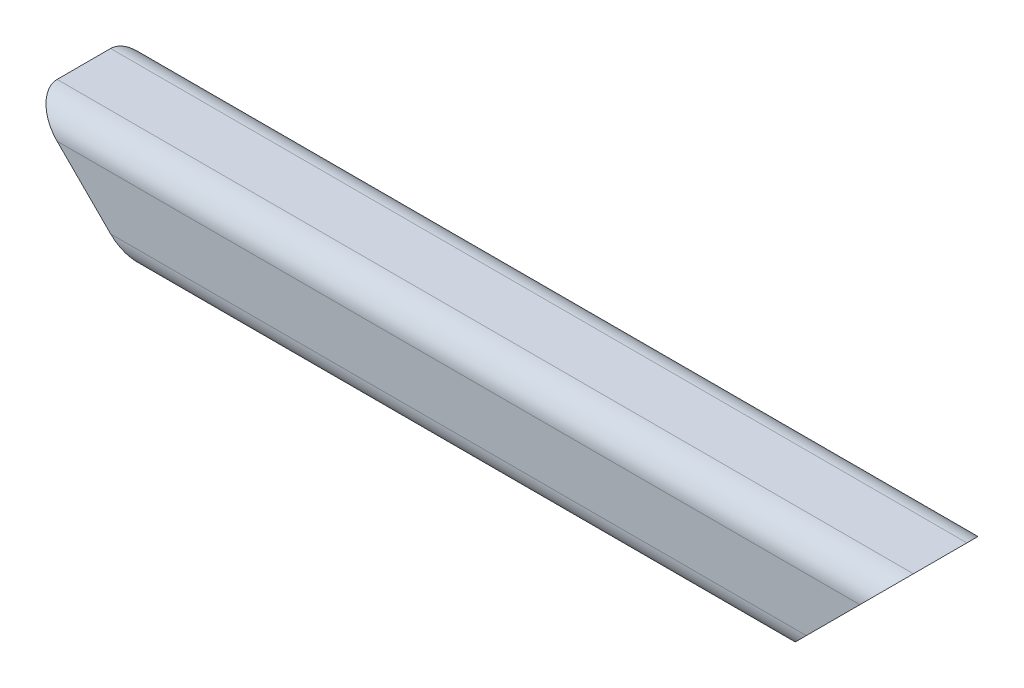
from build123d import *

# Parameters (mm, degrees)
STRUCTURAL_MEMBER1_DEPTH = 406.4
CUT_EXTRUDE1_DEPTH       = 411.349558304


with BuildPart() as part:
    # Sketch11 → Structural Member1 (new body)
    with BuildSketch(Plane.ZY):
        with BuildLine():
            Line((-12.7, -25.4), (12.7, -25.4))
            ThreePointArc((12.7, -25.4), (21.680256121, -21.680256121), (25.4, -12.7))
            Line((25.4, -12.7), (25.4, 12.7))
            ThreePointArc((25.4, 12.7), (21.680256121, 21.680256121), (12.7, 25.4))
            Line((12.7, 25.4), (-12.7, 25.4))
            ThreePointArc((-12.7, 25.4), (-21.680256121, 21.680256121), (-25.4, 12.7))
            Line((-25.4, 12.7), (-25.4, -12.7))
            ThreePointArc((-25.4, -12.7), (-21.680256121, -21.680256121), (-12.7, -25.4))
        make_face()
        with BuildLine():
            Line((-12.7, -22.225), (12.7, -22.225))
            ThreePointArc((12.7, -22.225), (19.435192091, -19.435192091), (22.225, -12.7))
            Line((22.225, -12.7), (22.225, 12.7))
            ThreePointArc((22.225, 12.7), (19.435192091, 19.435192091), (12.7, 22.225))
            Line((12.7, 22.225), (-12.7, 22.225))
            ThreePointArc((-12.7, 22.225), (-19.435192091, 19.435192091), (-22.225, 12.7))
            Line((-22.225, 12.7), (-22.225, -12.7))
            ThreePointArc((-22.225, -12.7), (-19.435192091, -19.435192091), (-12.7, -22.225))
        make_face(mode=Mode.SUBTRACT)
    extrude(amount=STRUCTURAL_MEMBER1_DEPTH)

    # Sketch2 → Cut-Extrude1 (cut, through all)
    with BuildSketch(Plane.XY.offset(25.4)):
        Polygon((-406.4, 25.4), (-355.6, -25.4), (-406.4, -25.4), align=None)
        Polygon((0, 25.4), (-50.8, -25.4), (0, -25.4), align=None)
    extrude(amount=-CUT_EXTRUDE1_DEPTH, mode=Mode.SUBTRACT)


solid = part.part
